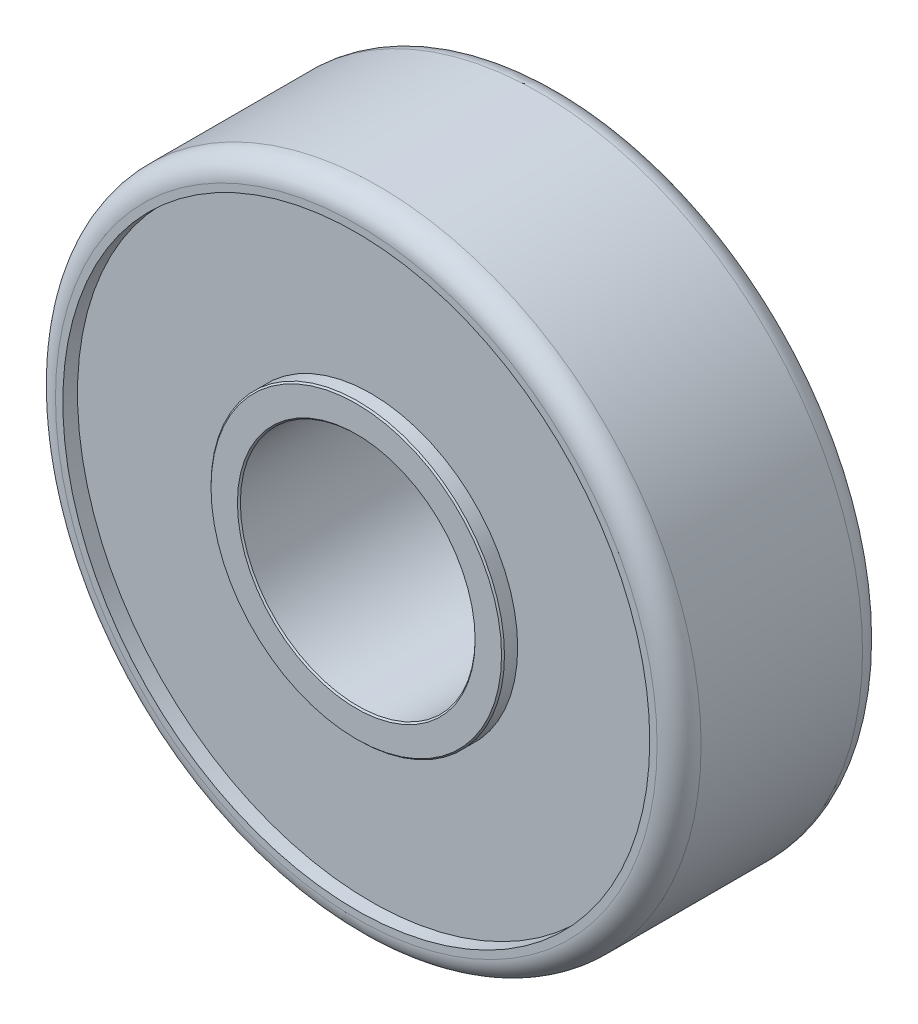
from build123d import *

# Parameters (mm, degrees)
ESQUISSE1_R             = 11
ESQUISSE1_R_2           = 4
BOSS_EXTRU_1_DEPTH      = 7
ESQUISSE2_R             = 10
ESQUISSE2_R_2           = 5
ENL_V_MAT_EXTRU_1_DEPTH = 0.5
ENL_V_START             = -0.5
ESQUISSE3_R             = 10
ESQUISSE3_R_2           = 5
ENL_V_MAT_EXTRU_2_DEPTH = 0.5
CONG_1_R                = 0.75
CHANFREIN1_SIZE         = 0.05


with BuildPart() as part:
    # Esquisse1 → Boss.-Extru.1 (new body)
    with BuildSketch(Plane.XY):
        Circle(ESQUISSE1_R)
        Circle(ESQUISSE1_R_2, mode=Mode.SUBTRACT)
    extrude(amount=BOSS_EXTRU_1_DEPTH)

    # Esquisse2 → Enlèv. mat.-Extru.1 (cut)
    with BuildSketch(Plane.XY.offset(7)):
        Circle(ESQUISSE2_R)
        Circle(ESQUISSE2_R_2, mode=Mode.SUBTRACT)
    extrude(amount=-ENL_V_MAT_EXTRU_1_DEPTH, mode=Mode.SUBTRACT)

    # Esquisse3 → Enlèv. mat.-Extru.2 (cut)
    with BuildSketch(Plane(origin=(0, 0, 0), x_dir=(-1, 0, 0), z_dir=(0, 0, -1)).offset(ENL_V_START)):
        with Locations(Location((0, 0, 0), (0, 0, 180))):
            Circle(ESQUISSE3_R)
        with Locations(Location((0, 0, 0), (0, 0, 180))):
            Circle(ESQUISSE3_R_2, mode=Mode.SUBTRACT)
    extrude(amount=ENL_V_MAT_EXTRU_2_DEPTH, mode=Mode.SUBTRACT)

    # Congé1
    cong_1_edges = [part.edges().sort_by_distance(p)[0] for p in [
        (-11, 0, 0),
        (-11, 0, 7),
    ]]
    fillet(cong_1_edges, radius=CONG_1_R)

    # Chanfrein1
    chanfrein1_edges = [part.edges().sort_by_distance(p)[0] for p in [
        (-5, 0, 7),
        (-5, 0, 0),
        (-4, 0, 0),
        (-4, 0, 7),
    ]]
    chamfer(chanfrein1_edges, length=CHANFREIN1_SIZE)


solid = part.part
